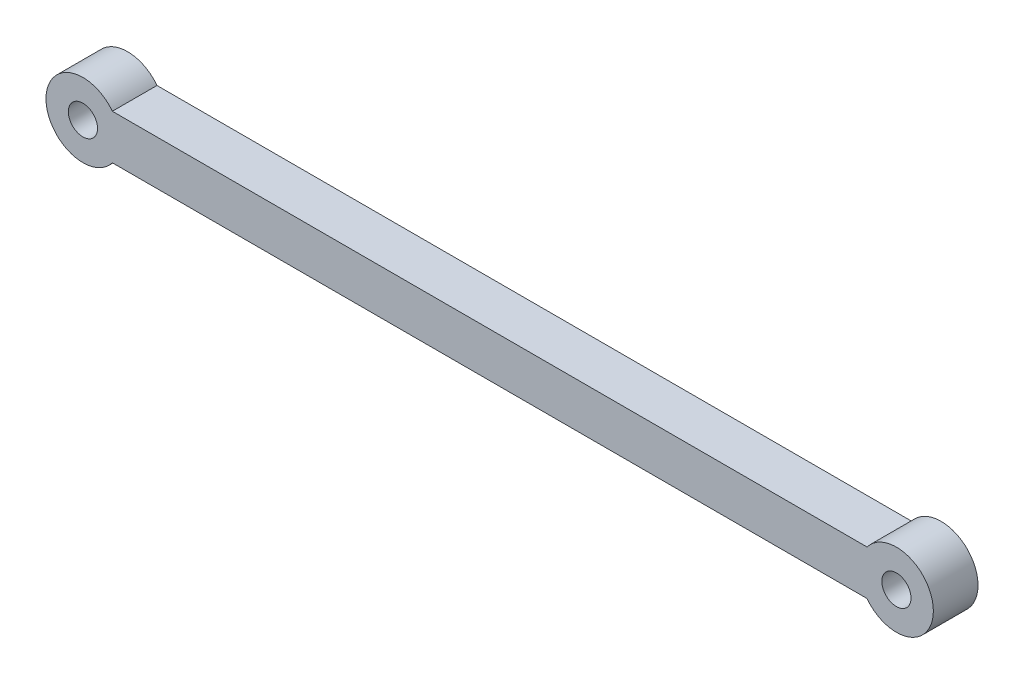
from build123d import *

# Parameters (mm, degrees)
SKETCH3_R           = 18.15695
SKETCH3_W           = 371.0727278
SKETCH3_H           = 21.9525
BOSS_EXTRUDE1_DEPTH = 10.97625
SKETCH4_R           = 7.1807
CUT_EXTRUDE1_DEPTH  = 645.139348927


with BuildPart() as part:
    # Sketch3 → Boss-Extrude1 (new, symmetric)
    with BuildSketch(Plane.XY):
        with Locations((-625.352112676, 0)):
            Circle(SKETCH3_R)
        with Locations((-225.352112676, 0)):
            Circle(SKETCH3_R)
        with Locations((-425.352112676, 0)):
            Rectangle(SKETCH3_W, SKETCH3_H)
    extrude(amount=BOSS_EXTRUDE1_DEPTH, both=True)

    # Sketch4 → Cut-Extrude1 (cut, through all)
    with BuildSketch(Plane.XY.offset(10.97625)):
        with Locations((-625.352112676, 0)):
            Circle(SKETCH4_R)
        with Locations((-225.352112676, 0)):
            Circle(SKETCH4_R)
    extrude(amount=-CUT_EXTRUDE1_DEPTH, mode=Mode.SUBTRACT)


solid = part.part
